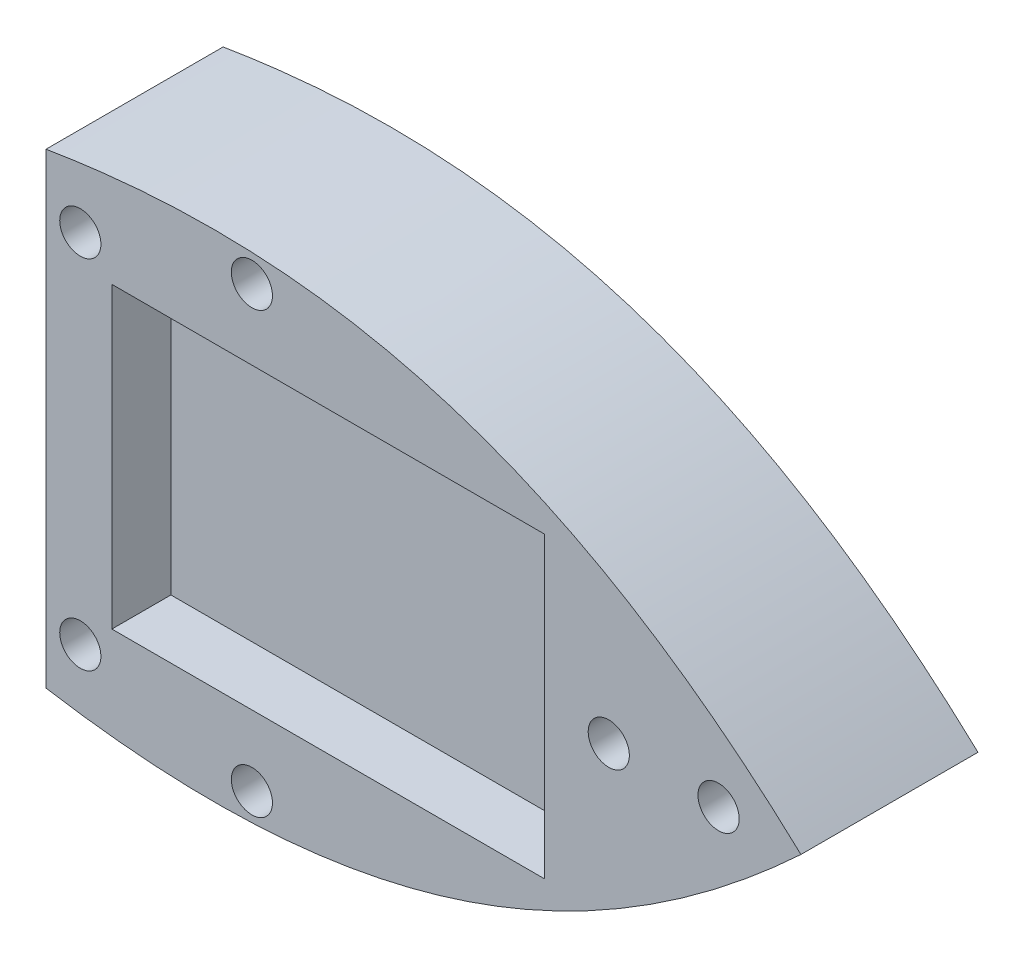
from build123d import *

# Parameters (mm, degrees)
SKETCH1_R           = 1.5
SKETCH1_W           = 31.5
SKETCH1_H           = 21.75
BOSS_EXTRUDE2_DEPTH = 12.9
SKETCH4_W           = 31.5
SKETCH4_H           = 21.75
BOSS_EXTRUDE3_DEPTH = 8.6


with BuildPart() as part:
    # Sketch1 → Boss-Extrude2 (new body)
    with BuildSketch(Plane.XY):
        with BuildLine():
            Line((-27.5, -17), (-27.5, 17))
            add(Edge.make_bspline(
                [(-27.5, 17), (-7.117727258, 20.399822972), (10.514459211, 15.859666911), (27.5, 0)],
                knots=[0, 0, 0, 0, 1, 1, 1, 1], degree=3))
            add(Edge.make_bspline(
                [(-27.5, -17), (-7.117727258, -20.399822972), (10.514459211, -15.859666911), (27.5, 0)],
                knots=[0, 0, 0, 0, 1, 1, 1, 1], degree=3))
        make_face()
        with Locations(Location((-25, 13, 0), (0, 0, 180))):
            Circle(SKETCH1_R, mode=Mode.SUBTRACT)
        with Locations(Location((-12.5, 16, 0), (0, 0, 180))):
            Circle(SKETCH1_R, mode=Mode.SUBTRACT)
        with Locations(Location((21.5, 0, 0), (0, 0, 180))):
            Circle(SKETCH1_R, mode=Mode.SUBTRACT)
        with Locations(Location((13.5, 0, 0), (0, 0, 180))):
            Circle(SKETCH1_R, mode=Mode.SUBTRACT)
        with Locations(Location((-12.5, -16, 0), (0, 0, 180))):
            Circle(SKETCH1_R, mode=Mode.SUBTRACT)
        with Locations(Location((-25, -13, 0), (0, 0, 180))):
            Circle(SKETCH1_R, mode=Mode.SUBTRACT)
        with Locations((-6.95, 0)):
            Rectangle(SKETCH1_W, SKETCH1_H, mode=Mode.SUBTRACT)
    extrude(amount=BOSS_EXTRUDE2_DEPTH)

    # Sketch4 → Boss-Extrude3 (add)
    with BuildSketch(Plane(origin=(0, 0, 0), x_dir=(-1, 0, 0), z_dir=(0, 0, -1))):
        with Locations((6.95, 0)):
            Rectangle(SKETCH4_W, SKETCH4_H)
    extrude(amount=-BOSS_EXTRUDE3_DEPTH)


solid = part.part
